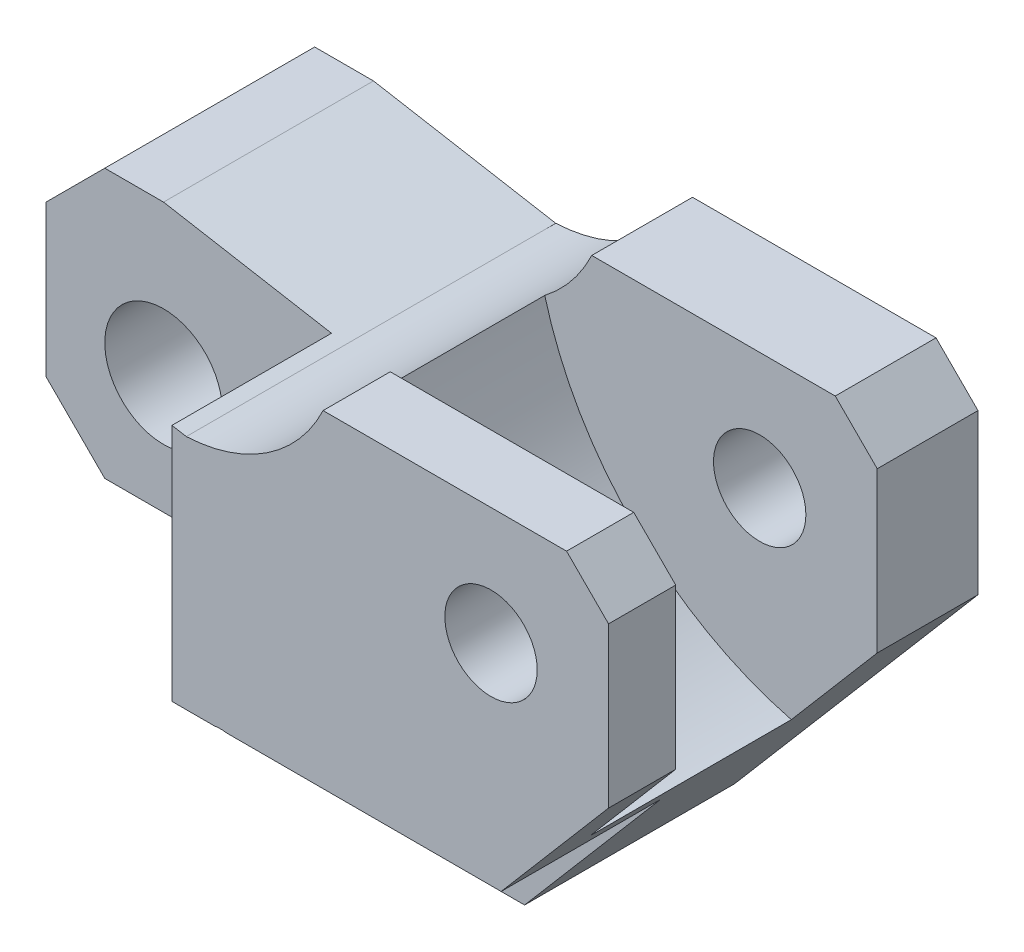
from build123d import *

# Parameters (mm, degrees)
BOSS_EXTRU_1_DEPTH      = 44
ESQUISSE2_R             = 7
ENL_V_MAT_EXTRU_1_DEPTH = 44
ENL_V_MAT_EXTRU_2_DEPTH = 19
ESQUISSE4_R             = 5.5
ENL_V_MAT_EXTRU_3_DEPTH = 50
ENL_V_START             = -19
ENL_V_MAT_EXTRU_5_DEPTH = 19
ENL_V_START_2           = -32
ENL_V_MAT_EXTRU_8_DEPTH = 32
BOSS_EXTRU_3_START      = -8
BOSS_EXTRU_3_DEPTH      = 8
ESQUISSE15_R            = 5.5
ENL_V_MAT_EXTRU_9_DEPTH = 44


with BuildPart() as part:
    # Esquisse1 → Boss.-Extru.1 (new body)
    with BuildSketch(Plane.XY):
        with BuildLine():
            Line((69.055498862, 42.585779817), (98.055498862, 42.585779817))
            Line((98.055498862, 42.585779817), (103.055498862, 37.585779817))
            Line((103.055498862, 37.585779817), (103.055498862, 18.585779817))
            Line((103.055498862, 18.585779817), (74.055498862, -15.414220183))
            Line((74.055498862, -15.414220183), (68.352478915, -15.414220183))
            ThreePointArc((68.352478915, -15.414220183), (64.19229693, -9.118662105), (61.797161375, -1.962930743))
            ThreePointArc((61.797161375, -1.962930743), (60.309086392, 2.242265049), (56.055498862, 3.585779817))
            Line((56.055498862, 3.585779817), (24.055498862, 3.585779817))
            Line((24.055498862, 3.585779817), (17.055498862, 10.585779817))
            Line((17.055498862, 10.585779817), (17.055498862, 28.585779817))
            Line((17.055498862, 28.585779817), (24.055498862, 35.585779817))
            Line((24.055498862, 35.585779817), (31.055498862, 35.585779817))
            Line((31.055498862, 35.585779817), (52.765077496, 31.757795364))
            ThreePointArc((52.765077496, 31.757795364), (62.410764196, 34.914360395), (69.055498862, 42.585779817))
        make_face()
    extrude(amount=BOSS_EXTRU_1_DEPTH)

    # Esquisse2 → Enlèv. mat.-Extru.1 (cut)
    with BuildSketch(Plane.XY.offset(44)):
        with Locations((31.055498862, 17.585779817)):
            Circle(ESQUISSE2_R)
    extrude(amount=-ENL_V_MAT_EXTRU_1_DEPTH, mode=Mode.SUBTRACT)

    # Esquisse3 → Enlèv. mat.-Extru.2 (cut)
    with BuildSketch(Plane.XY.offset(44)):
        Polygon((17.055498862, 28.585779817), (17.055498862, 10.585779817), (24.055498862, 3.585779817), (51.055498862, 3.585779817), (51.055498862, 32.059240202), (31.055498862, 35.585779817), (24.055498862, 35.585779817), align=None)
    extrude(amount=-ENL_V_MAT_EXTRU_2_DEPTH, mode=Mode.SUBTRACT)

    # Esquisse4 → Enlèv. mat.-Extru.3 (cut)
    with BuildSketch(Plane.XY.offset(44)):
        with Locations((89.055498862, 28.585779817)):
            Circle(ESQUISSE4_R)
    extrude(amount=-ENL_V_MAT_EXTRU_3_DEPTH, mode=Mode.SUBTRACT)

    # Esquisse10 → Enlèv. mat.-Extru.5 (cut)
    with BuildSketch(Plane.XY.offset(44).offset(ENL_V_START)):
        with BuildLine():
            Line((56.055498862, 3.585779817), (90.261381215, 3.585779817))
            Line((90.261381215, 3.585779817), (74.055498862, -15.414220183))
            Line((74.055498862, -15.414220183), (68.352478915, -15.414220183))
            ThreePointArc((68.352478915, -15.414220183), (64.19229693, -9.118662105), (61.797161375, -1.962930743))
            ThreePointArc((61.797161375, -1.962930743), (60.047831429, 1.971925154), (56.055498862, 3.585779817))
        make_face()
    extrude(amount=ENL_V_MAT_EXTRU_5_DEPTH, mode=Mode.SUBTRACT)

    # Esquisse13 → Enlèv. mat.-Extru.8 (cut)
    with BuildSketch(Plane.XY.offset(44).offset(ENL_V_START_2)):
        with BuildLine():
            Line((69.055498862, 42.585779817), (98.055498862, 42.585779817))
            Line((98.055498862, 42.585779817), (103.055498862, 37.585779817))
            Line((103.055498862, 37.585779817), (103.055498862, 18.585779817))
            Line((103.055498862, 18.585779817), (92.820204745, 6.585779817))
            ThreePointArc((92.820204745, 6.585779817), (74.207332122, 17.1537679), (63.456424114, 35.661587231))
            ThreePointArc((63.456424114, 35.661587231), (66.667333439, 38.791037909), (69.055498862, 42.585779817))
        make_face()
    extrude(amount=ENL_V_MAT_EXTRU_8_DEPTH, mode=Mode.SUBTRACT)

    # Esquisse14 → Boss.-Extru.3 (add)
    with BuildSketch(Plane.XY.offset(44).offset(BOSS_EXTRU_3_START)):
        with BuildLine():
            Line((92.820204745, 6.585779817), (103.055498862, 18.585779817))
            Line((103.055498862, 18.585779817), (103.055498862, 37.585779817))
            Line((103.055498862, 37.585779817), (98.055498862, 42.585779817))
            Line((98.055498862, 42.585779817), (69.055498862, 42.585779817))
            ThreePointArc((69.055498862, 42.585779817), (66.667333439, 38.791037909), (63.456424114, 35.661587231))
            ThreePointArc((63.456424114, 35.661587231), (74.207332122, 17.1537679), (92.820204745, 6.585779817))
        make_face()
    extrude(amount=BOSS_EXTRU_3_DEPTH)

    # Esquisse15 → Enlèv. mat.-Extru.9 (cut)
    with BuildSketch(Plane.XY.offset(44)):
        with Locations((89.055498862, 28.585779817)):
            Circle(ESQUISSE15_R)
    extrude(amount=-ENL_V_MAT_EXTRU_9_DEPTH, mode=Mode.SUBTRACT)


solid = part.part
